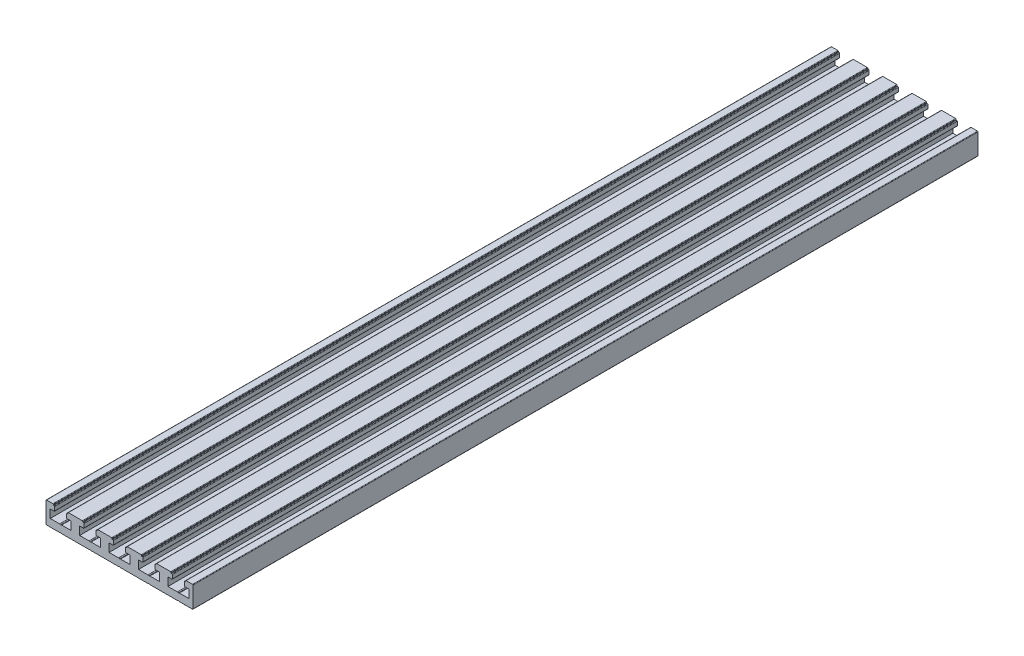
from build123d import *

# Parameters (mm, degrees)
RAWPART_DEPTH                                  = 400
CSK_FOR_M3_FLAT_HEAD_MACHINE_SCREW1_AT_2_COUNT = 2
CSK_FOR_M3_FLAT_HEAD_MACHINE_SCREW1_AT_2_PITCH = 60
CSK_FOR_M3_FLAT_HEAD_MACHINE_SCREW1_AT_3_COUNT = 2
CSK_FOR_M3_FLAT_HEAD_MACHINE_SCREW1_AT_3_PITCH = 271.707515505
CSK_FOR_M3_FLAT_HEAD_MACHINE_SCREW1_AT_4_COUNT = 2
CSK_FOR_M3_FLAT_HEAD_MACHINE_SCREW1_AT_4_PITCH = 264.999950909
M4X0_7_TAPPED_HOLE1_D                          = 3.3


with BuildPart() as part:
    # Sketch1 → RawPart (new body)
    with BuildSketch(Plane(origin=(0, 0, 0), x_dir=(-1, 0, 0), z_dir=(0, 0, -1))):
        with BuildLine():
            Line((-37.45, 8.85), (-37.45, -1.65))
            ThreePointArc((-37.45, -1.65), (-37.376776695, -1.826776695), (-37.2, -1.9))
            Line((-37.2, -1.9), (-30.543629459, -1.9))
            ThreePointArc((-30.543629459, -1.9), (-30.500649598, -1.896277753), (-30.458949592, -1.885221853))
            Line((-30.458949592, -1.885221853), (-30, -1.72))
            Line((-30, -1.72), (-29.541050408, -1.885221853))
            ThreePointArc((-29.541050408, -1.885221853), (-29.499350402, -1.896277753), (-29.456370541, -1.9))
            Line((-29.456370541, -1.9), (-15.543629459, -1.9))
            ThreePointArc((-15.543629459, -1.9), (-15.500649598, -1.896277753), (-15.458949592, -1.885221853))
            Line((-15.458949592, -1.885221853), (-15, -1.72))
            Line((-15, -1.72), (-14.541050408, -1.885221853))
            ThreePointArc((-14.541050408, -1.885221853), (-14.499350402, -1.896277753), (-14.456370541, -1.9))
            Line((-14.456370541, -1.9), (-0.543629459, -1.9))
            ThreePointArc((-0.543629459, -1.9), (-0.500649598, -1.896277753), (-0.458949592, -1.885221853))
            Line((-0.458949592, -1.885221853), (0, -1.72))
            Line((0, -1.72), (0.458949592, -1.885221853))
            ThreePointArc((0.458949592, -1.885221853), (0.500649598, -1.896277753), (0.543629459, -1.9))
            Line((0.543629459, -1.9), (14.456370541, -1.9))
            ThreePointArc((14.456370541, -1.9), (14.499350402, -1.896277753), (14.541050408, -1.885221853))
            Line((14.541050408, -1.885221853), (15, -1.72))
            Line((15, -1.72), (15.458949592, -1.885221853))
            ThreePointArc((15.458949592, -1.885221853), (15.500649598, -1.896277753), (15.543629459, -1.9))
            Line((15.543629459, -1.9), (29.456370541, -1.9))
            ThreePointArc((29.456370541, -1.9), (29.499350402, -1.896277753), (29.541050408, -1.885221853))
            Line((29.541050408, -1.885221853), (30, -1.72))
            Line((30, -1.72), (30.458949592, -1.885221853))
            ThreePointArc((30.458949592, -1.885221853), (30.500649598, -1.896277753), (30.543629459, -1.9))
            Line((30.543629459, -1.9), (37.2, -1.9))
            ThreePointArc((37.2, -1.9), (37.376776695, -1.826776695), (37.45, -1.65))
            Line((37.45, -1.65), (37.45, 8.85))
            ThreePointArc((37.45, 8.85), (37.376776695, 9.026776695), (37.2, 9.1))
            Line((37.2, 9.1), (33.95, 9.1))
            ThreePointArc((33.95, 9.1), (33.773223305, 9.026776695), (33.7, 8.85))
            Line((33.7, 8.85), (33.7, 8.5))
            Line((33.7, 8.5), (33.32, 8.5))
            ThreePointArc((33.32, 8.5), (33.143223305, 8.426776695), (33.07, 8.25))
            Line((33.07, 8.25), (33.07, 6.35))
            ThreePointArc((33.07, 6.35), (33.143223305, 6.173223305), (33.32, 6.1))
            Line((33.32, 6.1), (35.3, 6.1))
            Line((35.3, 6.1), (35.3, 1.9))
            Line((35.3, 1.9), (30.543629459, 1.9))
            ThreePointArc((30.543629459, 1.9), (30.500649598, 1.896277753), (30.458949592, 1.885221853))
            Line((30.458949592, 1.885221853), (30, 1.72))
            Line((30, 1.72), (29.541050408, 1.885221853))
            ThreePointArc((29.541050408, 1.885221853), (29.499350402, 1.896277753), (29.456370541, 1.9))
            Line((29.456370541, 1.9), (24.7, 1.9))
            Line((24.7, 1.9), (24.7, 6.1))
            Line((24.7, 6.1), (26.68, 6.1))
            ThreePointArc((26.68, 6.1), (26.856776695, 6.173223305), (26.93, 6.35))
            Line((26.93, 6.35), (26.93, 8.25))
            ThreePointArc((26.93, 8.25), (26.856776695, 8.426776695), (26.68, 8.5))
            Line((26.68, 8.5), (26.3, 8.5))
            Line((26.3, 8.5), (26.3, 8.85))
            ThreePointArc((26.3, 8.85), (26.226776695, 9.026776695), (26.05, 9.1))
            Line((26.05, 9.1), (18.95, 9.1))
            ThreePointArc((18.95, 9.1), (18.773223305, 9.026776695), (18.7, 8.85))
            Line((18.7, 8.85), (18.7, 8.5))
            Line((18.7, 8.5), (18.32, 8.5))
            ThreePointArc((18.32, 8.5), (18.143223305, 8.426776695), (18.07, 8.25))
            Line((18.07, 8.25), (18.07, 6.35))
            ThreePointArc((18.07, 6.35), (18.143223305, 6.173223305), (18.32, 6.1))
            Line((18.32, 6.1), (20.3, 6.1))
            Line((20.3, 6.1), (20.3, 1.9))
            Line((20.3, 1.9), (15.543629459, 1.9))
            ThreePointArc((15.543629459, 1.9), (15.500649598, 1.896277753), (15.458949592, 1.885221853))
            Line((15.458949592, 1.885221853), (15, 1.72))
            Line((15, 1.72), (14.541050408, 1.885221853))
            ThreePointArc((14.541050408, 1.885221853), (14.499350402, 1.896277753), (14.456370541, 1.9))
            Line((14.456370541, 1.9), (9.7, 1.9))
            Line((9.7, 1.9), (9.7, 6.1))
            Line((9.7, 6.1), (11.68, 6.1))
            ThreePointArc((11.68, 6.1), (11.856776695, 6.173223305), (11.93, 6.35))
            Line((11.93, 6.35), (11.93, 8.25))
            ThreePointArc((11.93, 8.25), (11.856776695, 8.426776695), (11.68, 8.5))
            Line((11.68, 8.5), (11.3, 8.5))
            Line((11.3, 8.5), (11.3, 8.85))
            ThreePointArc((11.3, 8.85), (11.226776695, 9.026776695), (11.05, 9.1))
            Line((11.05, 9.1), (3.95, 9.1))
            ThreePointArc((3.95, 9.1), (3.773223305, 9.026776695), (3.7, 8.85))
            Line((3.7, 8.85), (3.7, 8.5))
            Line((3.7, 8.5), (3.32, 8.5))
            ThreePointArc((3.32, 8.5), (3.143223305, 8.426776695), (3.07, 8.25))
            Line((3.07, 8.25), (3.07, 6.35))
            ThreePointArc((3.07, 6.35), (3.143223305, 6.173223305), (3.32, 6.1))
            Line((3.32, 6.1), (5.3, 6.1))
            Line((5.3, 6.1), (5.3, 1.9))
            Line((5.3, 1.9), (0.543629459, 1.9))
            ThreePointArc((0.543629459, 1.9), (0.500649598, 1.896277753), (0.458949592, 1.885221853))
            Line((0.458949592, 1.885221853), (0, 1.72))
            Line((0, 1.72), (-0.458949592, 1.885221853))
            ThreePointArc((-0.458949592, 1.885221853), (-0.500649598, 1.896277753), (-0.543629459, 1.9))
            Line((-0.543629459, 1.9), (-5.3, 1.9))
            Line((-5.3, 1.9), (-5.3, 6.1))
            Line((-5.3, 6.1), (-3.32, 6.1))
            ThreePointArc((-3.32, 6.1), (-3.143223305, 6.173223305), (-3.07, 6.35))
            Line((-3.07, 6.35), (-3.07, 8.25))
            ThreePointArc((-3.07, 8.25), (-3.143223305, 8.426776695), (-3.32, 8.5))
            Line((-3.32, 8.5), (-3.7, 8.5))
            Line((-3.7, 8.5), (-3.7, 8.85))
            ThreePointArc((-3.7, 8.85), (-3.773223305, 9.026776695), (-3.95, 9.1))
            Line((-3.95, 9.1), (-11.05, 9.1))
            ThreePointArc((-11.05, 9.1), (-11.226776695, 9.026776695), (-11.3, 8.85))
            Line((-11.3, 8.85), (-11.3, 8.5))
            Line((-11.3, 8.5), (-11.68, 8.5))
            ThreePointArc((-11.68, 8.5), (-11.856776695, 8.426776695), (-11.93, 8.25))
            Line((-11.93, 8.25), (-11.93, 6.35))
            ThreePointArc((-11.93, 6.35), (-11.856776695, 6.173223305), (-11.68, 6.1))
            Line((-11.68, 6.1), (-9.7, 6.1))
            Line((-9.7, 6.1), (-9.7, 1.9))
            Line((-9.7, 1.9), (-14.456370541, 1.9))
            ThreePointArc((-14.456370541, 1.9), (-14.499350402, 1.896277753), (-14.541050408, 1.885221853))
            Line((-14.541050408, 1.885221853), (-15, 1.72))
            Line((-15, 1.72), (-15.458949592, 1.885221853))
            ThreePointArc((-15.458949592, 1.885221853), (-15.500649598, 1.896277753), (-15.543629459, 1.9))
            Line((-15.543629459, 1.9), (-20.3, 1.9))
            Line((-20.3, 1.9), (-20.3, 6.1))
            Line((-20.3, 6.1), (-18.32, 6.1))
            ThreePointArc((-18.32, 6.1), (-18.143223305, 6.173223305), (-18.07, 6.35))
            Line((-18.07, 6.35), (-18.07, 8.25))
            ThreePointArc((-18.07, 8.25), (-18.143223305, 8.426776695), (-18.32, 8.5))
            Line((-18.32, 8.5), (-18.7, 8.5))
            Line((-18.7, 8.5), (-18.7, 8.85))
            ThreePointArc((-18.7, 8.85), (-18.773223305, 9.026776695), (-18.95, 9.1))
            Line((-18.95, 9.1), (-26.05, 9.1))
            ThreePointArc((-26.05, 9.1), (-26.226776695, 9.026776695), (-26.3, 8.85))
            Line((-26.3, 8.85), (-26.3, 8.5))
            Line((-26.3, 8.5), (-26.68, 8.5))
            ThreePointArc((-26.68, 8.5), (-26.856776695, 8.426776695), (-26.93, 8.25))
            Line((-26.93, 8.25), (-26.93, 6.35))
            ThreePointArc((-26.93, 6.35), (-26.856776695, 6.173223305), (-26.68, 6.1))
            Line((-26.68, 6.1), (-24.7, 6.1))
            Line((-24.7, 6.1), (-24.7, 1.9))
            Line((-24.7, 1.9), (-29.456370541, 1.9))
            ThreePointArc((-29.456370541, 1.9), (-29.499350402, 1.896277753), (-29.541050408, 1.885221853))
            Line((-29.541050408, 1.885221853), (-30, 1.72))
            Line((-30, 1.72), (-30.458949592, 1.885221853))
            ThreePointArc((-30.458949592, 1.885221853), (-30.500649598, 1.896277753), (-30.543629459, 1.9))
            Line((-30.543629459, 1.9), (-35.3, 1.9))
            Line((-35.3, 1.9), (-35.3, 6.1))
            Line((-35.3, 6.1), (-33.32, 6.1))
            ThreePointArc((-33.32, 6.1), (-33.143223305, 6.173223305), (-33.07, 6.35))
            Line((-33.07, 6.35), (-33.07, 8.25))
            ThreePointArc((-33.07, 8.25), (-33.143223305, 8.426776695), (-33.32, 8.5))
            Line((-33.32, 8.5), (-33.7, 8.5))
            Line((-33.7, 8.5), (-33.7, 8.85))
            ThreePointArc((-33.7, 8.85), (-33.773223305, 9.026776695), (-33.95, 9.1))
            Line((-33.95, 9.1), (-37.2, 9.1))
            ThreePointArc((-37.2, 9.1), (-37.376776695, 9.026776695), (-37.45, 8.85))
        make_face()
    extrude(amount=-RAWPART_DEPTH)

    # Sketch2 → CSK for M3 Flat Head Machine Screw1 (revolve, cut)
    with BuildSketch(Plane(origin=(-30, 1.9, 65), x_dir=(0, 0, 1), z_dir=(1, 0, 0))):
        Polygon((0, 0), (0, 3.8), (1.6, 3.8), (1.6, 1.9), (3, 0.5), (3, 0), align=None)
    csk_for_m3_flat_head_machine_screw1 = revolve(axis=Axis((-30, 8.25, 65), (0, -1, 0)), mode=Mode.SUBTRACT)

    # CSK for M3 Flat Head Machine Screw1 at 2: CSK for M3 Flat Head Machine Screw1 ×2
    with Locations(*[(i * CSK_FOR_M3_FLAT_HEAD_MACHINE_SCREW1_AT_2_PITCH, 0, 0) for i in range(1, CSK_FOR_M3_FLAT_HEAD_MACHINE_SCREW1_AT_2_COUNT)]):
        add(csk_for_m3_flat_head_machine_screw1, mode=Mode.SUBTRACT)

    # CSK for M3 Flat Head Machine Screw1 at 3: CSK for M3 Flat Head Machine Screw1 ×2
    with Locations(*[Vector(0.22082569151065257, 0, 0.9753132901631364) * (i * CSK_FOR_M3_FLAT_HEAD_MACHINE_SCREW1_AT_3_PITCH) for i in range(1, CSK_FOR_M3_FLAT_HEAD_MACHINE_SCREW1_AT_3_COUNT)]):
        add(csk_for_m3_flat_head_machine_screw1, mode=Mode.SUBTRACT)

    # CSK for M3 Flat Head Machine Screw1 at 4: CSK for M3 Flat Head Machine Screw1 ×2
    with Locations(*[(0, 0, i * CSK_FOR_M3_FLAT_HEAD_MACHINE_SCREW1_AT_4_PITCH) for i in range(1, CSK_FOR_M3_FLAT_HEAD_MACHINE_SCREW1_AT_4_COUNT)]):
        add(csk_for_m3_flat_head_machine_screw1, mode=Mode.SUBTRACT)

    # M4x0.7 Tapped Hole1 (through all)
    with Locations(Plane(origin=(0, 1.9, 0), x_dir=(1, 0, 0), z_dir=(0, 1, 0))):
        with Locations((15, -30), (15, -371)):
            Hole(M4X0_7_TAPPED_HOLE1_D / 2)


solid = part.part
